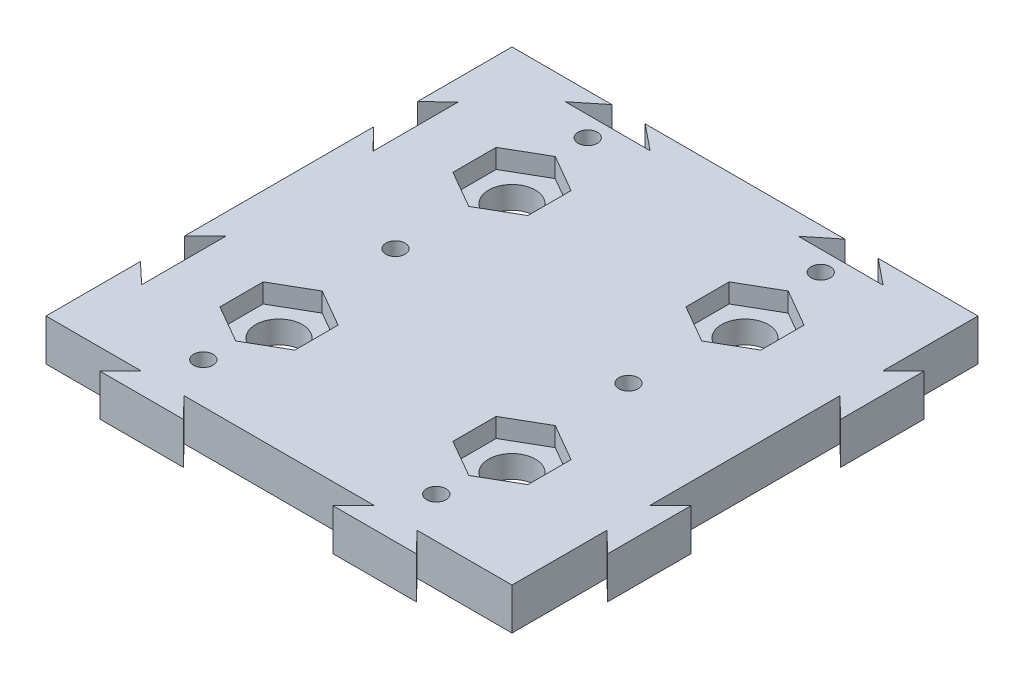
from build123d import *

# Parameters (mm, degrees)
SKETCH1_W             = 35.56
SKETCH1_H             = 35.56
BOSS_EXTRUDE1_DEPTH   = 6.35
CUT_EXTRUDE1_DEPTH    = 2.921
LPATTERN11_COUNT      = 2
LPATTERN11_PITCH      = 35.56
LPATTERN11_COUNT_DIR2 = 2
LPATTERN11_PITCH_DIR2 = 35.56
LPATTERN15_COUNT      = 2
LPATTERN15_PITCH      = 35.56
LPATTERN16_COUNT      = 2
LPATTERN16_PITCH      = 35.56
SKETCH20_W            = 3.175
SKETCH20_H            = 12.7
BOSS_EXTRUDE2_DEPTH   = 6.35
CUT_EXTRUDE2_DEPTH    = 76.700949135
SKETCH22_W            = 12.7
SKETCH22_H            = 3.175
BOSS_EXTRUDE3_DEPTH   = 6.35
CUT_EXTRUDE3_DEPTH    = 78.97065682
CUT_EXTRUDE4_DEPTH    = 78.97065682
CUT_EXTRUDE5_DEPTH    = 78.97065682


with BuildPart() as part:
    # Sketch1 → Boss-Extrude1 (new body)
    with BuildSketch(Plane(origin=(0, 0, 0), x_dir=(1, 0, 0), z_dir=(0, 1, 0))):
        Rectangle(SKETCH1_W, SKETCH1_H)
    boss_extrude1 = extrude(amount=BOSS_EXTRUDE1_DEPTH)

    # Sketch2 → Cut-Extrude1 (cut)
    with BuildSketch(Plane(origin=(0, 6.35, 0), x_dir=(1, 0, 0), z_dir=(0, 1, 0))):
        Polygon((0, 6.599113577), (-5.715, 3.299556788), (-5.715, -3.299556788), (0, -6.599113577), (5.715, -3.299556788), (5.715, 3.299556788), align=None)
    cut_extrude1 = extrude(amount=-CUT_EXTRUDE1_DEPTH, mode=Mode.SUBTRACT)

    # Sketch3 → 1/4 Clearance Hole1 (revolve, cut)
    with BuildSketch(Plane(origin=(0, 3.429, 0), x_dir=(0, 0, 1), z_dir=(1, 0, 0))):
        Polygon((0, 0), (0, 11.035817477), (3.57124, 8.89), (3.57124, 0), align=None)
    f_1_4_clearance_hole1 = revolve(axis=Axis((0, 9.779, 0), (0, -1, 0)), mode=Mode.SUBTRACT)

    # LPattern11: Boss-Extrude1, Cut-Extrude1, 1_4 Clearance Hole1 2 × 2
    with Locations(*[(-j * LPATTERN11_PITCH_DIR2, 0, i * LPATTERN11_PITCH) for i in range(LPATTERN11_COUNT) for j in range(LPATTERN11_COUNT_DIR2) if (i, j) != (0, 0)]):
        add(boss_extrude1)
        add(cut_extrude1, mode=Mode.SUBTRACT)
        add(f_1_4_clearance_hole1, mode=Mode.SUBTRACT)

    # Sketch15 → CBORE for #4 Socket Head Cap Screw5 (revolve, cut)
    with BuildSketch(Plane(origin=(0, 0, -11.557), x_dir=(0, 0, -1), z_dir=(1, 0, 0))):
        Polygon((0, 0), (0, 9.775187864), (1.4732, 8.89), (1.4732, 3.81), (2.794, 3.81), (2.794, 0), align=None)
    cbore_for_4_socket_head_cap_screw5 = revolve(axis=Axis((0, -6.35, -11.557), (0, 1, 0)), mode=Mode.SUBTRACT)

    # LPattern15: CBORE for #4 Socket Head Cap Screw5 ×2
    with Locations(*[(-i * LPATTERN15_PITCH, 0, 0) for i in range(1, LPATTERN15_COUNT)]):
        add(cbore_for_4_socket_head_cap_screw5, mode=Mode.SUBTRACT)

    # Sketch17 → CBORE for #4 Socket Head Cap Screw6 (revolve, cut)
    with BuildSketch(Plane(origin=(0, 0, 17.78), x_dir=(0, 0, -1), z_dir=(1, 0, 0))):
        Polygon((0, 0), (0, 9.775187864), (1.4732, 8.89), (1.4732, 3.81), (2.794, 3.81), (2.794, 0), align=None)
    cbore_for_4_socket_head_cap_screw6 = revolve(axis=Axis((0, -6.35, 17.78), (0, 1, 0)), mode=Mode.SUBTRACT)

    # LPattern16: CBORE for #4 Socket Head Cap Screw6 ×2
    with Locations(*[(-i * LPATTERN16_PITCH, 0, 0) for i in range(1, LPATTERN16_COUNT)]):
        add(cbore_for_4_socket_head_cap_screw6, mode=Mode.SUBTRACT)

    # Mirror1: CBORE for #4 Socket Head Cap Screw5 across plane
    add(cbore_for_4_socket_head_cap_screw5.mirror(Plane.XY.offset(17.78)), mode=Mode.SUBTRACT)

    # Mirror1 copy 1 sketch → Mirror1 copy 1 (revolve, cut)
    with BuildSketch(Plane(origin=(-35.56, 0, 47.117), x_dir=(0, 0, 1), z_dir=(1, 0, 0))):
        Polygon((0, 0), (0, -9.775187864), (1.4732, -8.89), (1.4732, -3.81), (2.794, -3.81), (2.794, 0), align=None)
    revolve(axis=Axis((-35.56, -6.35, 47.117), (0, -1, 0)), mode=Mode.SUBTRACT)

    # Sketch20 → Boss-Extrude2 (add)
    with BuildSketch(Plane(origin=(0, 0, 0), x_dir=(1, 0, 0), z_dir=(0, 1, 0))):
        with Locations((19.3675, 0)):
            Rectangle(SKETCH20_W, SKETCH20_H)
        with Locations((19.3675, -35.56)):
            Rectangle(SKETCH20_W, SKETCH20_H)
    extrude(amount=BOSS_EXTRUDE2_DEPTH)

    # Sketch21 → Cut-Extrude2 (cut, through all)
    with BuildSketch(Plane(origin=(0, 6.35, 0), x_dir=(1, 0, 0), z_dir=(0, 1, 0))):
        Polygon((20.955, -6.35), (17.78, -6.35), (17.78, -3.302), align=None)
        Polygon((20.955, 6.35), (17.78, 6.35), (17.78, 3.302), align=None)
        Polygon((20.955, -29.21), (17.78, -29.21), (17.78, -32.258), align=None)
        Polygon((20.955, -41.91), (17.78, -41.91), (17.78, -38.862), align=None)
    extrude(amount=-CUT_EXTRUDE2_DEPTH, mode=Mode.SUBTRACT)

    # Sketch22 → Boss-Extrude3 (add)
    with BuildSketch(Plane(origin=(0, 0, 0), x_dir=(1, 0, 0), z_dir=(0, 1, 0))):
        with Locations((-35.56, -54.9275)):
            Rectangle(SKETCH22_W, SKETCH22_H)
        with Locations((0, -54.9275)):
            Rectangle(SKETCH22_W, SKETCH22_H)
    extrude(amount=BOSS_EXTRUDE3_DEPTH)

    # Sketch23 → Cut-Extrude3 (cut, through all)
    with BuildSketch(Plane(origin=(0, 6.35, 0), x_dir=(1, 0, 0), z_dir=(0, 1, 0))):
        Polygon((-41.91, -56.515), (-41.91, -53.34), (-38.862, -53.34), align=None)
        Polygon((-29.21, -56.515), (-29.21, -53.34), (-32.258, -53.34), align=None)
        Polygon((-6.35, -56.515), (-6.35, -53.34), (-3.302, -53.34), align=None)
        Polygon((6.35, -56.515), (6.35, -53.34), (3.302, -53.34), align=None)
    extrude(amount=-CUT_EXTRUDE3_DEPTH, mode=Mode.SUBTRACT)

    # Sketch24 → Cut-Extrude4 (cut, through all)
    with BuildSketch(Plane(origin=(0, 6.35, 0), x_dir=(1, 0, 0), z_dir=(0, 1, 0))):
        Polygon((-53.34, 3.3655), (-53.34, -3.3655), (-50.165, -6.5913), (-50.165, 6.3627), align=None)
    cut_extrude4 = extrude(amount=-CUT_EXTRUDE4_DEPTH, mode=Mode.SUBTRACT)

    # Mirror2: Cut-Extrude4 across plane
    add(cut_extrude4.mirror(Plane.XY.offset(17.78)), mode=Mode.SUBTRACT)

    # Sketch25 → Cut-Extrude5 (cut, through all)
    with BuildSketch(Plane(origin=(0, 6.35, 0), x_dir=(1, 0, 0), z_dir=(0, 1, 0))):
        Polygon((-38.1, 17.78), (-33.02, 17.78), (-29.083, 14.605), (-42.037, 14.605), align=None)
        Polygon((-2.54, 17.78), (2.54, 17.78), (6.477, 14.605), (-6.477, 14.605), align=None)
    extrude(amount=-CUT_EXTRUDE5_DEPTH, mode=Mode.SUBTRACT)


solid = part.part
